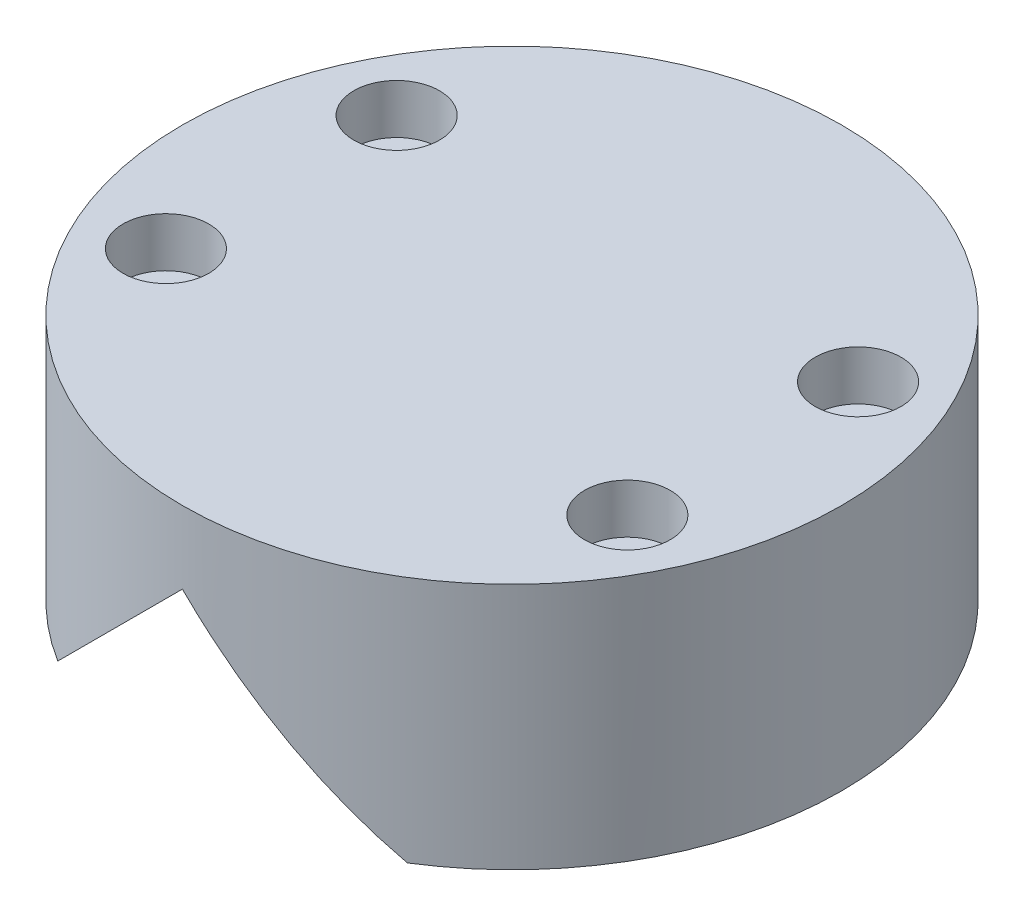
from build123d import *

# Parameters (mm, degrees)
SKETCH1_R               = 20
BOSS_EXTRUDE1_DEPTH     = 15
CUT_EXTRUDE1_DEPTH      = 25
CUT_EXTRUDE1_DEPTH_BACK = 25
CUT_EXTRUDE2_REACH      = 34.016
SKETCH3_R               = 1.5
SKETCH4_R               = 2.6
CUT_EXTRUDE3_DEPTH      = 3


with BuildPart() as part:
    # Sketch1 → Boss-Extrude1 (new body)
    with BuildSketch(Plane(origin=(0, 0, 0), x_dir=(1, 0, 0), z_dir=(0, 1, 0))):
        Circle(SKETCH1_R)
    extrude(amount=BOSS_EXTRUDE1_DEPTH)

    # Sketch2 → Cut-Extrude1 (cut, two sides: drawn at the far end of the back side and taken through both)
    with BuildSketch(Plane.XY.offset(-CUT_EXTRUDE1_DEPTH_BACK)):
        Polygon((-10.606601718, 0), (10.606601718, 0), (0, 10.606601718), align=None)
    extrude(amount=CUT_EXTRUDE1_DEPTH + CUT_EXTRUDE1_DEPTH_BACK, mode=Mode.SUBTRACT)

    # Sketch3 → Cut-Extrude2 (cut, up to next)
    with BuildSketch(Plane(origin=(0, 0, 0), x_dir=(-1, 0, 0), z_dir=(0, -1, 0)), mode=Mode.PRIVATE) as cut_extrude2_sk1:
        with Locations((14, -7)):
            Circle(SKETCH3_R)
    cut_extrude2_tool1 = extrude(cut_extrude2_sk1.sketch, amount=-CUT_EXTRUDE2_REACH, mode=Mode.PRIVATE) & part.part
    # Sketch3 → Cut-Extrude2 (cut, up to next)
    with BuildSketch(Plane(origin=(0, 0, 0), x_dir=(-1, 0, 0), z_dir=(0, -1, 0)), mode=Mode.PRIVATE) as cut_extrude2_sk2:
        with Locations((14, 7)):
            Circle(SKETCH3_R)
    cut_extrude2_tool2 = extrude(cut_extrude2_sk2.sketch, amount=-CUT_EXTRUDE2_REACH, mode=Mode.PRIVATE) & part.part
    # Sketch3 → Cut-Extrude2 (cut, up to next)
    with BuildSketch(Plane(origin=(0, 0, 0), x_dir=(-1, 0, 0), z_dir=(0, -1, 0)), mode=Mode.PRIVATE) as cut_extrude2_sk3:
        with Locations((-14, -7)):
            Circle(SKETCH3_R)
    cut_extrude2_tool3 = extrude(cut_extrude2_sk3.sketch, amount=-CUT_EXTRUDE2_REACH, mode=Mode.PRIVATE) & part.part
    # Sketch3 → Cut-Extrude2 (cut, up to next)
    with BuildSketch(Plane(origin=(0, 0, 0), x_dir=(-1, 0, 0), z_dir=(0, -1, 0)), mode=Mode.PRIVATE) as cut_extrude2_sk4:
        with Locations((-14, 7)):
            Circle(SKETCH3_R)
    cut_extrude2_tool4 = extrude(cut_extrude2_sk4.sketch, amount=-CUT_EXTRUDE2_REACH, mode=Mode.PRIVATE) & part.part
    add(cut_extrude2_tool1.solids().sort_by_distance((-14, 0, 7))[0], mode=Mode.SUBTRACT)
    add(cut_extrude2_tool2.solids().sort_by_distance((-14, 0, -7))[0], mode=Mode.SUBTRACT)
    add(cut_extrude2_tool3.solids().sort_by_distance((14, 0, 7))[0], mode=Mode.SUBTRACT)
    add(cut_extrude2_tool4.solids().sort_by_distance((14, 0, -7))[0], mode=Mode.SUBTRACT)

    # Sketch4 → Cut-Extrude3 (cut)
    with BuildSketch(Plane(origin=(0, 15, 0), x_dir=(1, 0, 0), z_dir=(0, 1, 0))):
        with Locations((-14, 7)):
            Circle(SKETCH4_R)
        with Locations((-14, -7)):
            Circle(SKETCH4_R)
        with Locations((14, 7)):
            Circle(SKETCH4_R)
        with Locations((14, -7)):
            Circle(SKETCH4_R)
    extrude(amount=-CUT_EXTRUDE3_DEPTH, mode=Mode.SUBTRACT)


solid = part.part
